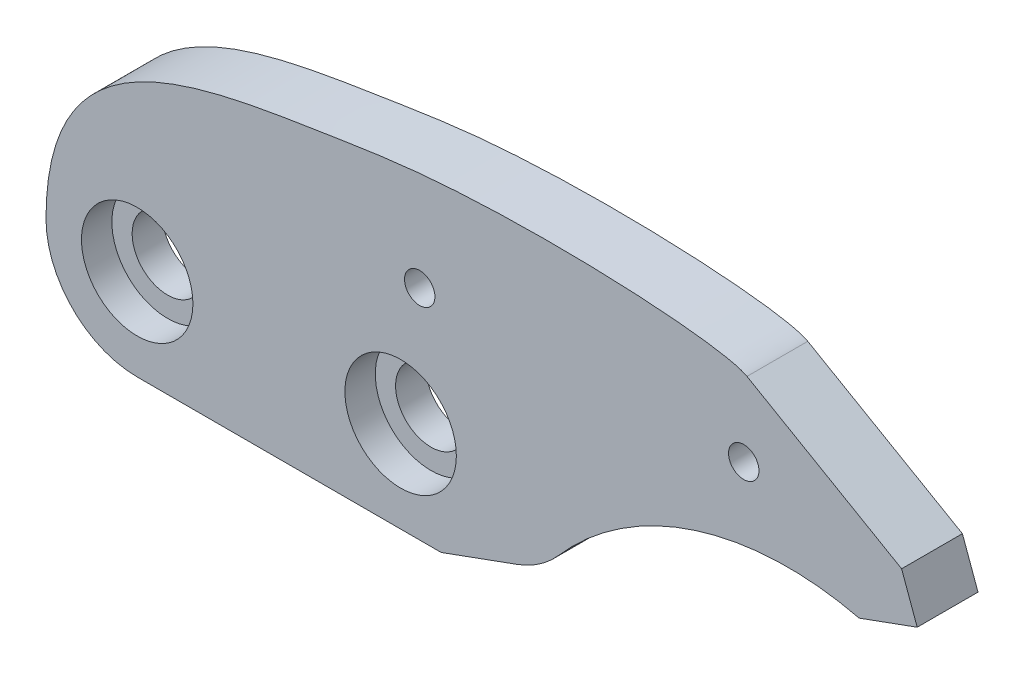
from build123d import *

# Parameters (mm, degrees)
SKETCH1_R           = 3.5
EXTRUSION1_DEPTH    = 6
SKETCH3_R           = 30
EXTRUSION3_DEPTH    = 10
FILLET2_R           = 10
BOSS_EXTRUDE1_DEPTH = 6
SKETCH8_R           = 1.5
CUT_EXTRUDE1_DEPTH  = 14
CUT_EXTRUDE2_START  = -6
SKETCH7_R           = 5.5
CUT_EXTRUDE2_DEPTH  = 3


with BuildPart() as part:
    # Sketch1 → Extrusion1 (new body)
    with BuildSketch(Plane.XY):
        with BuildLine():
            Line((0, -9), (30, -9))
            Line((30, -9), (76.984631039, 8.101007166))
            Line((76.984631039, 8.101007166), (75.445540394, 12.32962396))
            Line((75.445540394, 12.32962396), (60.183576084, 21.141123163))
            Line((60.183576084, 21.141123163), (26.826114347, 9))
            Line((26.826114347, 9), (0, 9))
            ThreePointArc((0, 9), (-9, 0), (0, -9))
        make_face()
        with Locations(Location((0, 0, 0), (0, 0, 180))):
            Circle(SKETCH1_R, mode=Mode.SUBTRACT)
        with Locations(Location((26, 0, 0), (0, 0, 180))):
            Circle(SKETCH1_R, mode=Mode.SUBTRACT)
    extrude(amount=EXTRUSION1_DEPTH)

    # Sketch3 → Extrusion3 (cut)
    with BuildSketch(Plane(origin=(0, 0, 0), x_dir=(-1, 0, 0), z_dir=(0, 0, -1))):
        with Locations((-64.222352322, -23.14852672)):
            Circle(SKETCH3_R)
    extrude(amount=-EXTRUSION3_DEPTH, mode=Mode.SUBTRACT)

    # Fillet2
    fillet2_edges = [part.edges().sort_by_distance(p)[0] for p in [
        (40.088809532, -5.327973631, 3),
    ]]
    fillet(fillet2_edges, radius=FILLET2_R)

    # Sketch6 → Boss-Extrude1 (add)
    with BuildSketch(Plane(origin=(0, 0, 0), x_dir=(-1, 0, 0), z_dir=(0, 0, -1))):
        with BuildLine():
            ThreePointArc((0, 9), (6.363961031, 6.363961031), (9, 0))
            add(Edge.make_bspline(
                [(-60.183576084, 21.141123163), (-57.582994943, 22.642569384), (-35.785366448, 23.838648882), (-8.377062942, 19.440019234), (9, 16.91404675), (9, 0)],
                knots=[0, 0, 0, 0, 0.435384133, 0.535384133, 1, 1, 1, 1], degree=3))
            Line((-60.183576084, 21.141123163), (-26.826114347, 9))
            Line((-26.826114347, 9), (0, 9))
        make_face()
    extrude(amount=-BOSS_EXTRUDE1_DEPTH)

    # Sketch8 → Cut-Extrude1 (cut)
    with BuildSketch(Plane(origin=(0, 0, 0), x_dir=(-1, 0, 0), z_dir=(0, 0, -1))):
        with Locations((-59.865613746, 13.663313065)):
            Circle(SKETCH8_R)
        with Locations((-27.885107281, 12.546529171)):
            Circle(SKETCH8_R)
    extrude(amount=-CUT_EXTRUDE1_DEPTH, mode=Mode.SUBTRACT)

    # Sketch7 → Cut-Extrude2 (cut)
    with BuildSketch(Plane(origin=(0, 0, 0), x_dir=(-1, 0, 0), z_dir=(0, 0, -1)).offset(CUT_EXTRUDE2_START)):
        with Locations(Location((0, 0, 0), (0, 0, 180))):
            Circle(SKETCH7_R)
        with Locations(Location((-26, 0, 0), (0, 0, 180))):
            Circle(SKETCH7_R)
    extrude(amount=CUT_EXTRUDE2_DEPTH, mode=Mode.SUBTRACT)


solid = part.part
